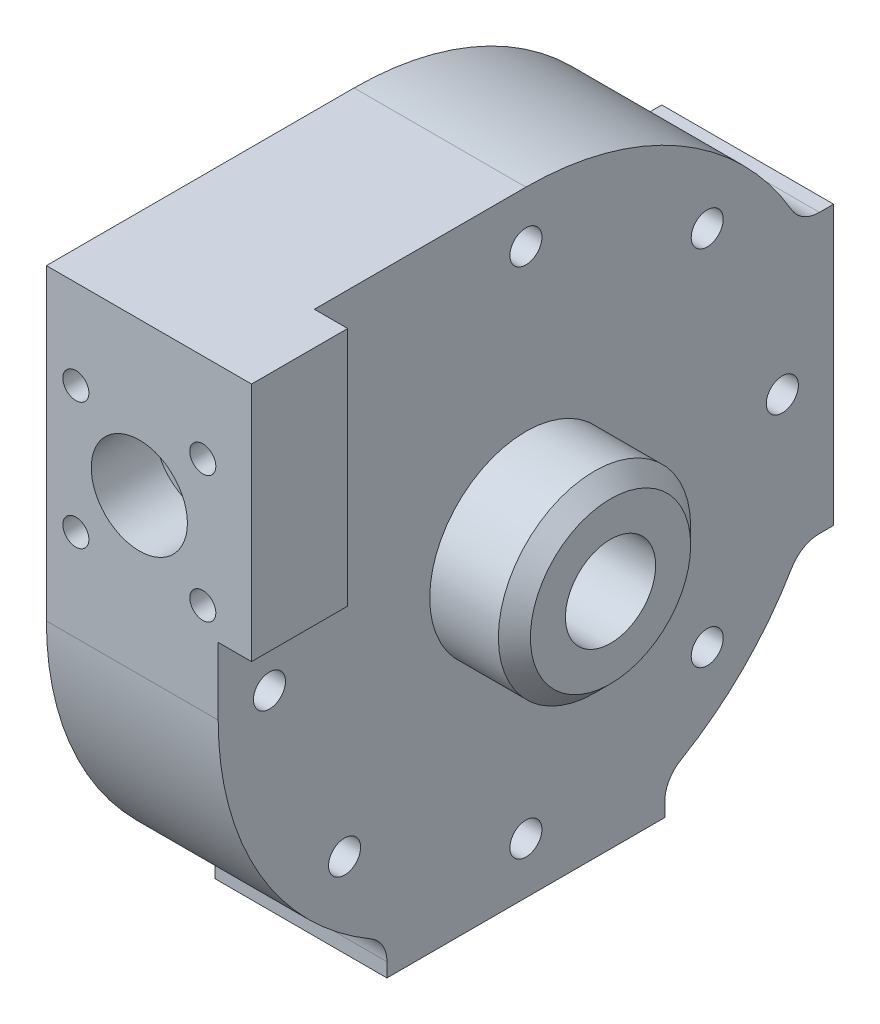
from build123d import *

# Parameters (mm, degrees)
HOUSING_2_DEPTH          = 44.45
SKETCH2_R                = 36.6649
IMPELLER_CUT_DEPTH       = 22.4028
SKETCH4_R                = 4.826
INLET_CUT_DEPTH          = 19.8628
SKETCH6_R                = 3.175
FASTENER_BORE_DEPTH      = 116.84
FASTENER_PATTERN_COUNT   = 8
SKETCH7_R                = 100.114274451
SKETCH7_R_2              = 19.05
MASS_REDUCTION_CUT_DEPTH = 10.414
SKETCH11_R               = 19.05
SKETCH11_R_2             = 4.826
BOSS_EXTRUDE1_DEPTH      = 6.35
SKETCH14_R               = 2.38125
CUT_EXTRUDE3_DEPTH       = 99.06
SKETCH15_R               = 9.525
CUT_EXTRUDE4_DEPTH       = 25.4
BOSS_EXTRUDE2_START      = 12.7
SKETCH16_R               = 9.525
SKETCH16_R_2             = 6.35
BOSS_EXTRUDE2_DEPTH      = 12.7
SKETCH18_W               = 6.604
SKETCH18_H               = 47.625
BOSS_EXTRUDE3_DEPTH      = 19.05
SKETCH19_R               = 2.5781
CUT_EXTRUDE5_DEPTH       = 17.78
CIRPATTERN2_COUNT        = 4
FILLET9_R                = 6.35
SKETCH22_R               = 8.9281
CUT_EXTRUDE8_DEPTH       = 17.78
CHAMFER1_SIZE            = 3.175


with BuildPart() as part:
    # Sketch1 → Housing 2 (new body)
    with BuildSketch(Plane(origin=(0, 0, 0), x_dir=(0, 0, -1), z_dir=(1, 0, 0))):
        with BuildLine():
            Line((-60.96, 0), (-60.96, 60.96))
            Line((-60.96, 60.96), (0, 60.96))
            ThreePointArc((0, 60.96), (31.907091375, 51.942844743), (54.374839025, 27.559))
            Line((54.374839025, 27.559), (60.96, 27.559))
            Line((60.96, 27.559), (60.96, -27.559))
            Line((60.96, -27.559), (54.374839025, -27.559))
            ThreePointArc((54.374839025, -27.559), (43.093739421, -43.116716279), (27.530012063, -54.389521379))
            Line((27.530012063, -54.389521379), (27.530012063, -60.96))
            Line((27.530012063, -60.96), (-27.530012063, -60.96))
            Line((-27.530012063, -60.96), (-27.530012063, -54.389521379))
            ThreePointArc((-27.530012063, -54.389521379), (-51.934339003, -31.920934077), (-60.96, 0))
        make_face()
    extrude(amount=HOUSING_2_DEPTH)

    # Sketch2 → Impeller Cut (cut)
    with BuildSketch(Plane.ZY):
        Circle(SKETCH2_R)
    extrude(amount=-IMPELLER_CUT_DEPTH, mode=Mode.SUBTRACT)

    # Sketch3 → Impeller Angle Cut (revolve, cut)
    with BuildSketch(Plane.XY, mode=Mode.PRIVATE) as impeller_angle_cut_sk:
        Polygon((28.08333914, 9.28793198), (22.4028, 36.6649), (22.225, 0), (28.08333914, 0), align=None)
    revolve(impeller_angle_cut_sk.sketch.rotate(Axis((22.225, 0, 0), (1, 0, 0)), 180), axis=Axis((22.225, 0, 0), (1, 0, 0)), mode=Mode.SUBTRACT)

    # Sketch4 → Inlet Cut (cut)
    with BuildSketch(Plane.ZY.offset(-28.08333914)):
        Circle(SKETCH4_R)
    extrude(amount=-INLET_CUT_DEPTH, mode=Mode.SUBTRACT)

    # Sketch6 → Fastener Bore (cut)
    with BuildSketch(Plane(origin=(44.45, 0, 0), x_dir=(0, 0, -1), z_dir=(1, 0, 0))):
        with Locations((50.8, 0)):
            Circle(SKETCH6_R)
    fastener_bore = extrude(amount=-FASTENER_BORE_DEPTH, mode=Mode.SUBTRACT)

    # Fastener Pattern: Fastener Bore ×8 about axis, 1 skipped
    fastener_pattern_axis = Axis((0, 0, 0), (-1, 0, 0))
    add([fastener_bore.rotate(fastener_pattern_axis, i * 360 / FASTENER_PATTERN_COUNT) for i in range(1, FASTENER_PATTERN_COUNT) if i not in (5,)], mode=Mode.SUBTRACT)

    # Sketch7 → Mass Reduction Cut (cut)
    with BuildSketch(Plane(origin=(44.45, 0, 0), x_dir=(0, 0, -1), z_dir=(1, 0, 0))):
        Circle(SKETCH7_R)
        Circle(SKETCH7_R_2, mode=Mode.SUBTRACT)
    extrude(amount=-MASS_REDUCTION_CUT_DEPTH, mode=Mode.SUBTRACT)

    # Sketch11 → Boss-Extrude1 (add)
    with BuildSketch(Plane(origin=(44.45, 0, 0), x_dir=(0, 0, -1), z_dir=(1, 0, 0))):
        Circle(SKETCH11_R)
        with Locations(Location((0, 0, 0), (0, 0, 180))):
            Circle(SKETCH11_R_2, mode=Mode.SUBTRACT)
    extrude(amount=BOSS_EXTRUDE1_DEPTH)

    # Sketch14 → Cut-Extrude3 (cut)
    with BuildSketch(Plane.XY):
        with Locations(Location((18.415, 30.734, 0), (0, 0, 180))):
            Circle(SKETCH14_R)
    extrude(amount=CUT_EXTRUDE3_DEPTH, mode=Mode.SUBTRACT)

    # Sketch15 → Cut-Extrude4 (cut)
    with BuildSketch(Plane.XY.offset(60.96)):
        with Locations((18.415, 30.734)):
            Circle(SKETCH15_R)
    extrude(amount=-CUT_EXTRUDE4_DEPTH, mode=Mode.SUBTRACT)

    # Sketch16 → Boss-Extrude2 (add)
    with BuildSketch(Plane.XY.offset(35.56).offset(BOSS_EXTRUDE2_START)):
        with Locations((18.415, 30.734)):
            Circle(SKETCH16_R)
        with Locations(Location((18.415, 30.734, 0), (0, 0, 180))):
            Circle(SKETCH16_R_2, mode=Mode.SUBTRACT)
    extrude(amount=-BOSS_EXTRUDE2_DEPTH)

    # Sketch18 → Boss-Extrude3 (add)
    with BuildSketch(Plane.XY.offset(60.96)):
        with Locations((37.338, 37.1475)):
            Rectangle(SKETCH18_W, SKETCH18_H)
    extrude(amount=-BOSS_EXTRUDE3_DEPTH)

    # Sketch19 → Cut-Extrude5 (cut)
    with BuildSketch(Plane.XY.offset(60.96)):
        with Locations((30.987358569, 18.161641431)):
            Circle(SKETCH19_R)
    cut_extrude5 = extrude(amount=-CUT_EXTRUDE5_DEPTH, mode=Mode.SUBTRACT)

    # CirPattern2: Cut-Extrude5 ×4 about axis
    cirpattern2_axis = Axis((18.415, 30.734, 0), (0, 0, 1))
    for i in range(1, CIRPATTERN2_COUNT):
        add(cut_extrude5.rotate(cirpattern2_axis, i * 360 / CIRPATTERN2_COUNT), mode=Mode.SUBTRACT)

    # Fillet9
    fillet9_edges = [part.edges().sort_by_distance(p)[0] for p in [
        (17.018, 27.559, -54.374839025),
        (17.018, -27.559, -54.374839025),
        (17.018, -54.389521379, -27.530012063),
        (17.018, -54.389521379, 27.530012063),
    ]]
    fillet(fillet9_edges, radius=FILLET9_R)

    # Sketch22 → Cut-Extrude8 (cut)
    with BuildSketch(Plane(origin=(50.8, 0, 0), x_dir=(0, 0, -1), z_dir=(1, 0, 0))):
        Circle(SKETCH22_R)
    extrude(amount=-CUT_EXTRUDE8_DEPTH, mode=Mode.SUBTRACT)

    # Chamfer1
    chamfer1_edges = [part.edges().sort_by_distance(p)[0] for p in [
        (50.8, 0, 19.05),
    ]]
    chamfer(chamfer1_edges, length=CHAMFER1_SIZE)


solid = part.part
